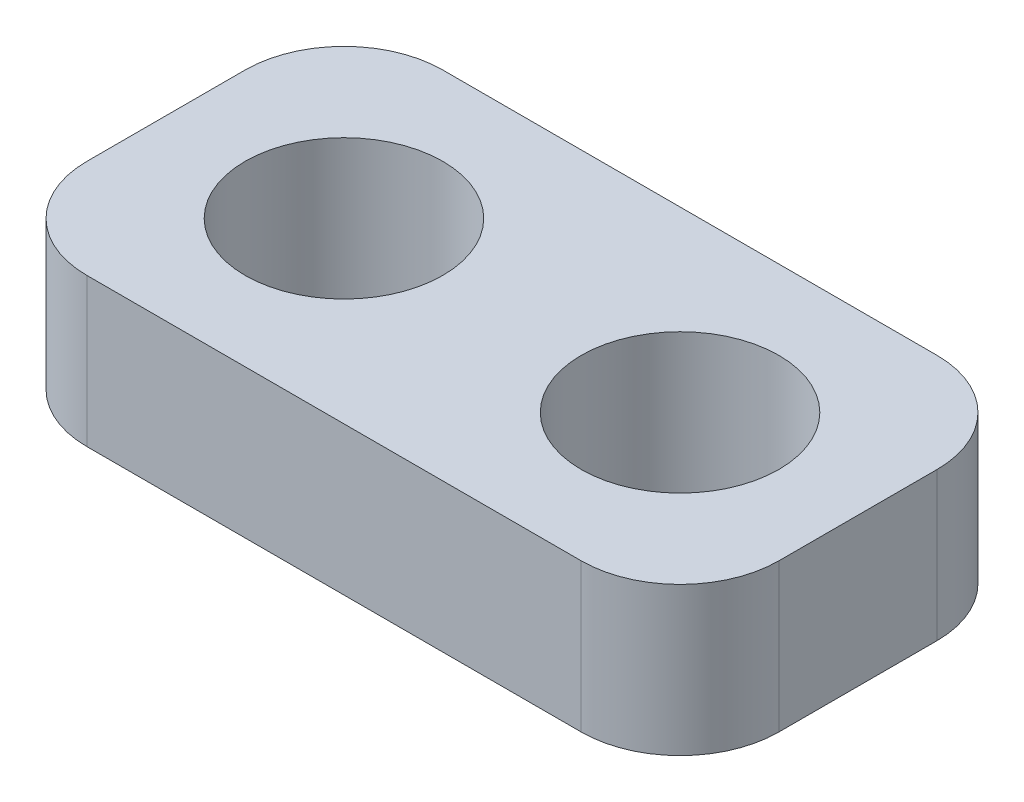
from build123d import *

# Parameters (mm, degrees)
SKETCH1_W           = 70
SKETCH1_H           = 36
SKETCH1_R           = 10
BOSS_EXTRUDE1_DEPTH = 15
FILLET1_R           = 10


with BuildPart() as part:
    # Sketch1 → Boss-Extrude1 (new body)
    with BuildSketch(Plane(origin=(0, 0, 0), x_dir=(1, 0, 0), z_dir=(0, 1, 0))):
        with Locations((-17, 0)):
            Rectangle(SKETCH1_W, SKETCH1_H)
        with Locations(Location((0, 0, 0), (0, 0, 270))):
            Circle(SKETCH1_R, mode=Mode.SUBTRACT)
        with Locations(Location((-34, 0, 0), (0, 0, 270))):
            Circle(SKETCH1_R, mode=Mode.SUBTRACT)
    extrude(amount=BOSS_EXTRUDE1_DEPTH)

    # Fillet1
    fillet1_edges = [part.edges().sort_by_distance(p)[0] for p in [
        (-52, 7.5, 18),
        (-52, 7.5, -18),
        (18, 7.5, -18),
        (18, 7.5, 18),
    ]]
    fillet(fillet1_edges, radius=FILLET1_R)


solid = part.part
